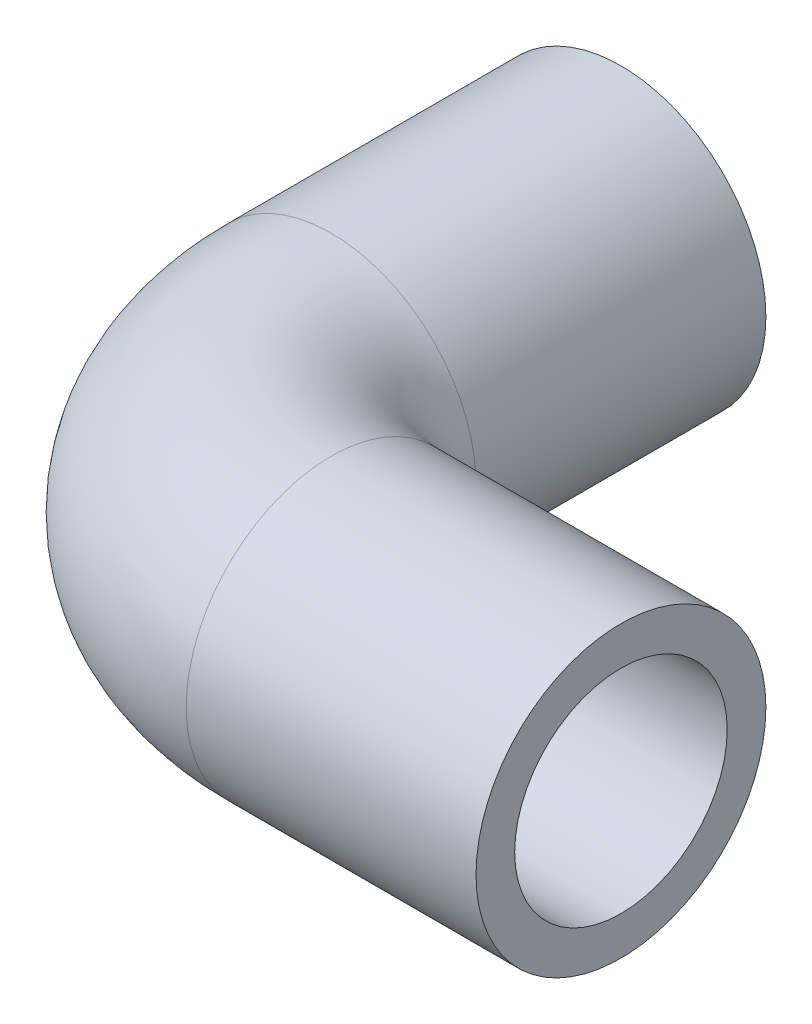
from build123d import *

# Parameters (mm, degrees)
SWEEP1_PROFILE_R   = 37.5
SHELL1_T           = -10
CUT_EXTRUDE1_REACH = 234.849
SKETCH2_R          = 27.5


with BuildPart() as part:
    # Sweep1: sweep along a path in Sketch1
    with BuildLine(Plane(origin=(0, 0, 0), x_dir=(1, 0, 0), z_dir=(0, 1, 0))) as sweep1_path:
        Line((0, 0), (-75, 0))
        ThreePointArc((-75, 0), (-110.355339059, 14.644660941), (-125, 50))
        Line((-125, 50), (-125, 125))
    # Sweep1 profile (on start of the path) → Sweep1 (sweep)
    with BuildSketch(Plane(origin=(0, 0, 0), x_dir=(0, 0, -1), z_dir=(-1, 0, 0))):
        Circle(SWEEP1_PROFILE_R)
    sweep(path=sweep1_path.line)

    # Shell1
    shell1_openings = [part.faces().sort_by_distance(p)[0] for p in [
        (0, 0, 0),
    ]]
    offset(amount=SHELL1_T, openings=shell1_openings, kind=Kind.INTERSECTION)

    # Sketch2 → Cut-Extrude1 (cut, up to next)
    with BuildSketch(Plane(origin=(0, 0, -125), x_dir=(-1, 0, 0), z_dir=(0, 0, -1)), mode=Mode.PRIVATE) as cut_extrude1_sk1:
        with Locations((125, 0)):
            Circle(SKETCH2_R)
    cut_extrude1_tool1 = extrude(cut_extrude1_sk1.sketch, amount=-CUT_EXTRUDE1_REACH, mode=Mode.PRIVATE) & part.part
    add(cut_extrude1_tool1.solids().sort_by_distance((-125, 0, -125))[0], mode=Mode.SUBTRACT)


solid = part.part
